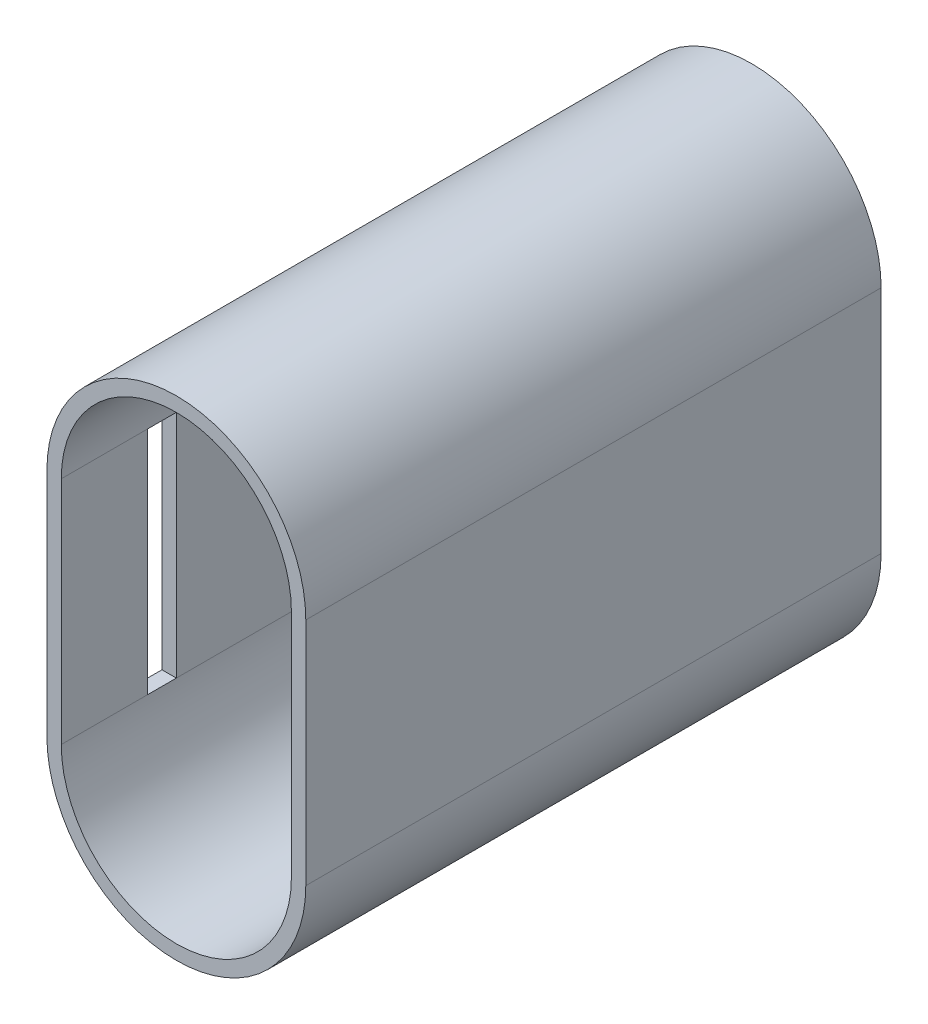
from build123d import *

# Parameters (mm, degrees)
EXTRUDE_355_DEPTH                 = 200
CUT_EXTRUDE_718_REACH             = 237.213
SKETCH_2_W                        = 13
SKETCH_2_H                        = 80
CUT_EXTRUDE_718_DIRECTION_2_DEPTH = 236.212669727
SKETCH_3_W                        = 10
SKETCH_3_H                        = 80
CUT_EXTRUDE_1071_DEPTH            = 5


with BuildPart() as part:
    # Эскиз1 → Extrude 355 (new body)
    with BuildSketch(Plane.XY):
        with BuildLine():
            Line((-45, -40), (-45, 40))
            ThreePointArc((-45, 40), (0, 85), (45, 40))
            Line((45, 40), (45, -40))
            ThreePointArc((45, -40), (0, -85), (-45, -40))
        make_face()
        with BuildLine():
            Line((-40, -40), (-40, 40))
            ThreePointArc((-40, 40), (0, 80), (40, 40))
            Line((40, 40), (40, -40))
            ThreePointArc((40, -40), (0, -80), (-40, -40))
        make_face(mode=Mode.SUBTRACT)
    extrude(amount=EXTRUDE_355_DEPTH)

    # Cut-Extrude 718: up to this face of the body (flat: up to its plane)
    cut_extrude_718_end = Plane(part.part.faces().sort_by_distance((-40, 0, 100))[0])
    # Эскиз2 → Cut-Extrude 718 (cut, up to the picked face)
    with BuildSketch(Plane.ZY.offset(45), mode=Mode.PRIVATE) as cut_extrude_718_sk1:
        with Locations((36.5, 0)):
            Rectangle(SKETCH_2_W, SKETCH_2_H)
    cut_extrude_718_tool1 = split(extrude(cut_extrude_718_sk1.sketch, amount=-CUT_EXTRUDE_718_REACH, mode=Mode.PRIVATE), bisect_by=cut_extrude_718_end, keep=Keep.BOTH, mode=Mode.PRIVATE)
    add(cut_extrude_718_tool1.solids().sort_by(Axis((-45, 0, 36.5), (1, 0, 0)))[0], mode=Mode.SUBTRACT)

    # Эскиз2 → Cut-Extrude 718 direction 2 (cut)
    with BuildSketch(Plane.ZY.offset(45)):
        with Locations((36.5, 0)):
            Rectangle(SKETCH_2_W, SKETCH_2_H)
    extrude(amount=CUT_EXTRUDE_718_DIRECTION_2_DEPTH, mode=Mode.SUBTRACT)

    # Эскиз3 → Cut-Extrude 1071 (cut)
    with BuildSketch(Plane.ZY.offset(45)):
        with Locations((165, 0)):
            Rectangle(SKETCH_3_W, SKETCH_3_H)
    extrude(amount=-CUT_EXTRUDE_1071_DEPTH, mode=Mode.SUBTRACT)


solid = part.part
